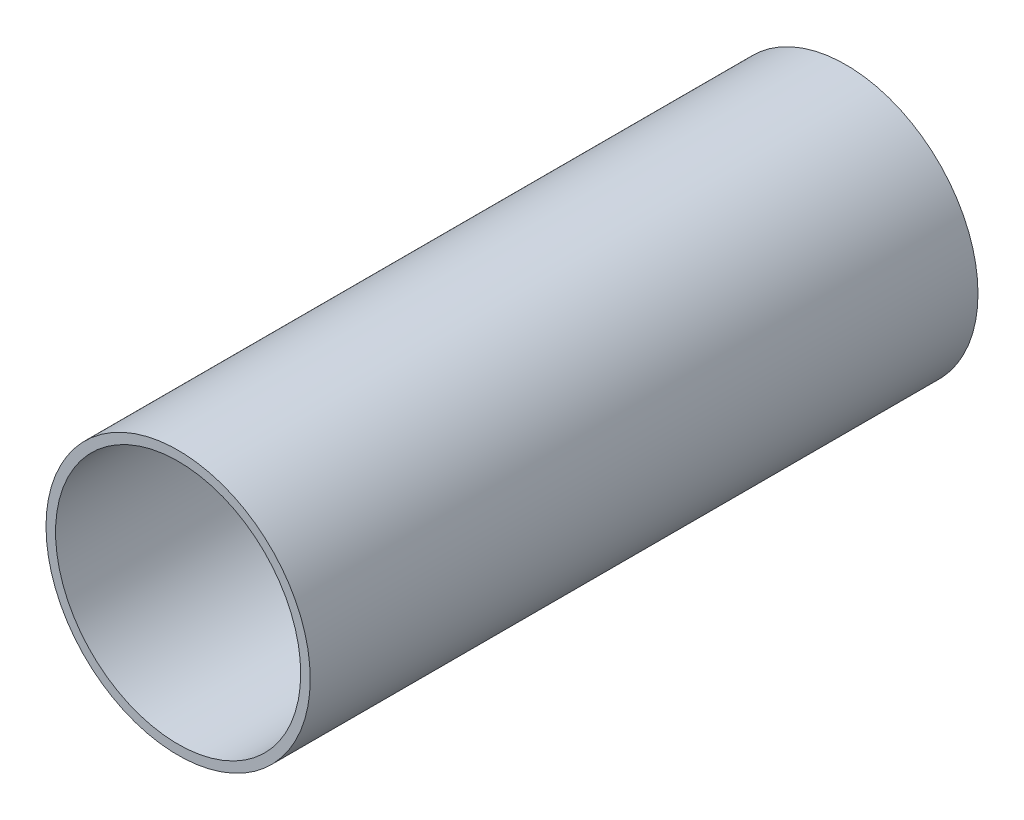
from build123d import *

# Parameters (mm, degrees)
ESBO_O1_W = 2
ESBO_O1_H = 140


with BuildPart() as part:
    # Esboço1 → Revolução2 (revolve)
    with BuildSketch(Plane(origin=(0, 0, 0), x_dir=(1, 0, 0), z_dir=(0, 1, 0))):
        with Locations((26.7, 70)):
            Rectangle(ESBO_O1_W, ESBO_O1_H)
    revolve(axis=Axis((0, 0, 0), (0, 0, -1)))


solid = part.part
